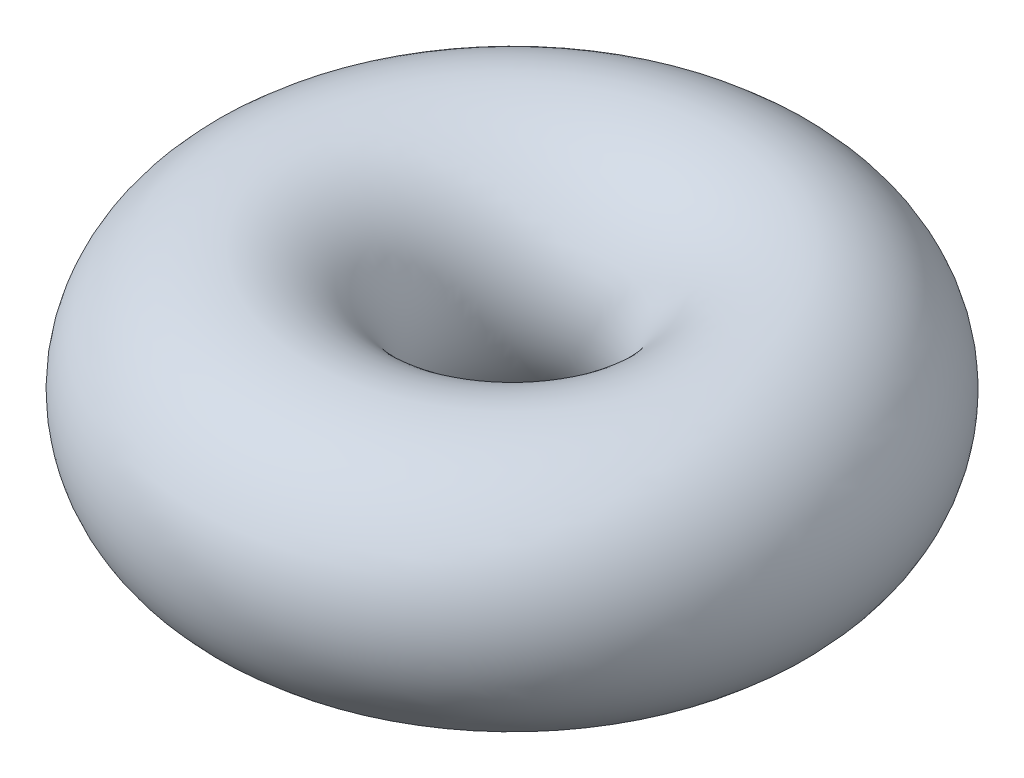
from build123d import *

# Parameters (mm, degrees)
SKETCH2_R = 1.5


with BuildPart() as part:
    # Sketch2 → Revolve1 (revolve)
    with BuildSketch(Plane.XY, mode=Mode.PRIVATE) as revolve1_sk:
        with Locations((2.5, 0)):
            Circle(SKETCH2_R)
    revolve(revolve1_sk.sketch.rotate(Axis((0, 4.996607078, 0), (0, -1, 0)), 180), axis=Axis((0, 4.996607078, 0), (0, -1, 0)))


solid = part.part
